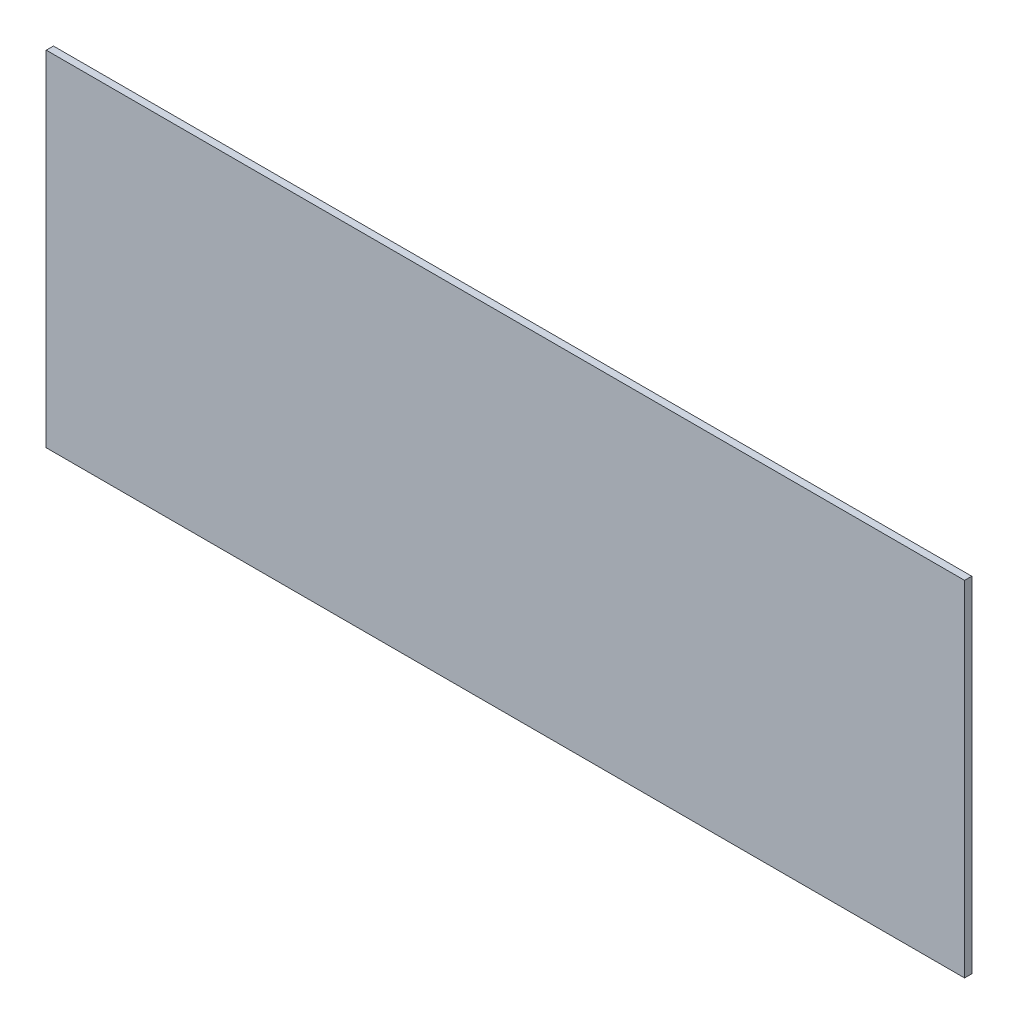
from build123d import *

# Parameters (mm, degrees)
SKETCH1_W           = 2438.4
SKETCH1_H           = 914.4
BOSS_EXTRUDE1_DEPTH = 19.05


with BuildPart() as part:
    # Sketch1 → Boss-Extrude1 (new body)
    with BuildSketch(Plane.XY):
        with Locations((1219.2, 457.2)):
            Rectangle(SKETCH1_W, SKETCH1_H)
    extrude(amount=BOSS_EXTRUDE1_DEPTH)


solid = part.part
